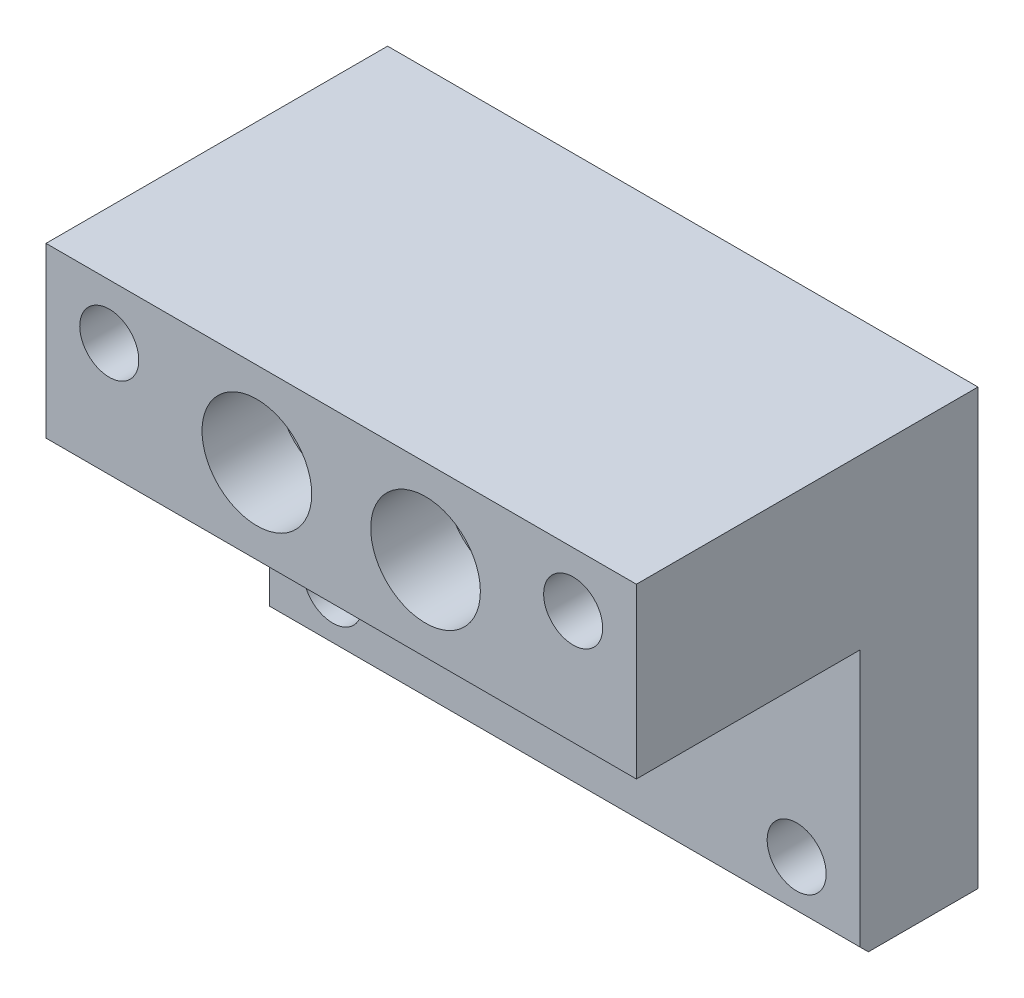
from build123d import *

# Parameters (mm, degrees)
SKIZZE1_W                                            = 140
SKIZZE1_H                                            = 103
BASIS_LINEAR_AUSTRAGEN_DEPTH                         = 40.5
SKIZZE8_W                                            = 53
SKIZZE8_H                                            = 63
SCHNITT_LINEAR_AUSTRAGEN1_DEPTH                      = 155.571989701
BOHRUNG1_D                                           = 18
BOHRUNG1_DEPTH                                       = 90
BOHRUNG1_CBORE_D                                     = 26
BOHRUNG1_CBORE_DEPTH                                 = 18
BOHRUNG2_D                                           = 18
BOHRUNG2_DEPTH                                       = 90
BOHRUNG2_CBORE_D                                     = 26
BOHRUNG2_CBORE_DEPTH                                 = 18
LINEARES_MUSTER1_COUNT                               = 2
LINEARES_MUSTER1_PITCH                               = 40
STIRNSENKUNG_F_R_M8_FLACHKOPFSCHRAUBE_MI_D           = 14
STIRNSENKUNG_F_R_M8_FLACHKOPFSCHRAUBE_MI_CBORE_D     = 20
STIRNSENKUNG_F_R_M8_FLACHKOPFSCHRAUBE_MI_CBORE_DEPTH = 13
SKIZZE11_R                                           = 13
SCHNITT_LINEAR_AUSTRAGEN2_DEPTH                      = 18
FASE1_SIZE                                           = 2


with BuildPart() as part:
    # Skizze1 → Basis-Linear austragen (new, symmetric)
    with BuildSketch(Plane.XY):
        Rectangle(SKIZZE1_W, SKIZZE1_H)
    extrude(amount=BASIS_LINEAR_AUSTRAGEN_DEPTH, both=True)

    # Skizze8 → Schnitt-Linear austragen1 (cut, through all)
    with BuildSketch(Plane.ZY.offset(70)):
        with Locations((14, -20)):
            Rectangle(SKIZZE8_W, SKIZZE8_H)
    extrude(amount=-SCHNITT_LINEAR_AUSTRAGEN1_DEPTH, mode=Mode.SUBTRACT)

    # Bohrung1
    with Locations(Plane.XY.offset(40.5)):
        with Locations((0, -18.5)):
            CounterBoreHole(BOHRUNG1_D / 2, BOHRUNG1_CBORE_D / 2, BOHRUNG1_CBORE_DEPTH, depth=BOHRUNG1_DEPTH)

    # Bohrung2
    with Locations(Plane.XY.offset(40.5)):
        with Locations((20, 31.5)):
            bohrung2 = CounterBoreHole(BOHRUNG2_D / 2, BOHRUNG2_CBORE_D / 2, BOHRUNG2_CBORE_DEPTH, depth=BOHRUNG2_DEPTH)

    # Lineares Muster1: Bohrung2 ×2
    with Locations(*[(-i * LINEARES_MUSTER1_PITCH, 0, 0) for i in range(1, LINEARES_MUSTER1_COUNT)]):
        add(bohrung2, mode=Mode.SUBTRACT)

    # Stirnsenkung für M8 Flachkopfschraube mit Schlitz1 (through all)
    with Locations(Plane(origin=(0, 0, -40.5), x_dir=(-1, 0, 0), z_dir=(0, 0, -1))):
        with Locations((-55, -38.5), (-55, 38.5), (55, 38.5), (55, -38.5)):
            CounterBoreHole(STIRNSENKUNG_F_R_M8_FLACHKOPFSCHRAUBE_MI_D / 2, STIRNSENKUNG_F_R_M8_FLACHKOPFSCHRAUBE_MI_CBORE_D / 2, STIRNSENKUNG_F_R_M8_FLACHKOPFSCHRAUBE_MI_CBORE_DEPTH)

    # Skizze11 → Schnitt-Linear austragen2 (cut)
    with BuildSketch(Plane.XY.offset(-12.5)):
        with Locations((0, -18.5)):
            Circle(SKIZZE11_R)
    extrude(amount=-SCHNITT_LINEAR_AUSTRAGEN2_DEPTH, mode=Mode.SUBTRACT)

    # Fase1
    fase1_edges = [part.edges().sort_by_distance(p)[0] for p in [
        (0, -51.5, -12.5),
    ]]
    chamfer(fase1_edges, length=FASE1_SIZE)


solid = part.part
